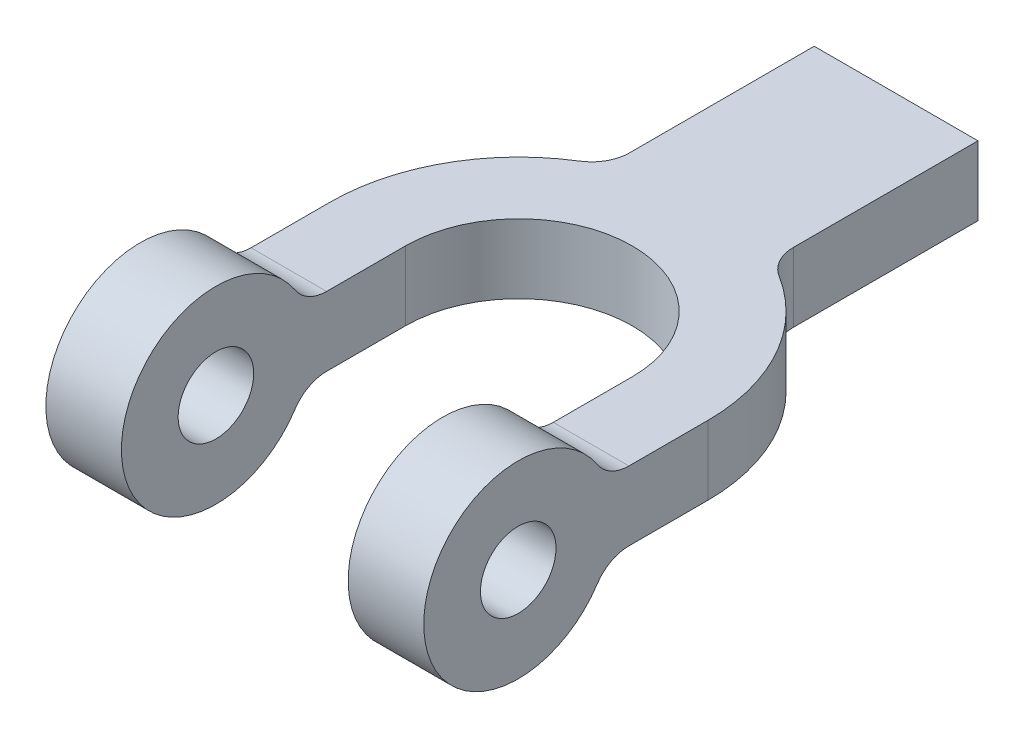
from build123d import *

# Parameters (mm, degrees)
SKETCH2_W           = 200
SKETCH2_H           = 350
BOSS_EXTRUDE1_DEPTH = 100
CUT_EXTRUDE3_DEPTH  = 226
SKETCH5_W           = 97.727308895
SKETCH5_H           = 31.680459025
CUT_EXTRUDE4_DEPTH  = 284.94541729


with BuildPart() as part:
    # Sketch2 → Boss-Extrude1 (new body)
    with BuildSketch(Plane(origin=(0, 0, 0), x_dir=(1, 0, 0), z_dir=(0, 1, 0))):
        Rectangle(SKETCH2_W, SKETCH2_H)
    extrude(amount=BOSS_EXTRUDE1_DEPTH)

    # Sketch4 → Cut-Extrude3 (cut, through all)
    with BuildSketch(Plane(origin=(0, 100, 0), x_dir=(1, 0, 0), z_dir=(0, 1, 0))):
        with BuildLine():
            Line((100, 175), (43.347633031, 175))
            Line((43.347633031, 175), (43.347633031, 77.272691105))
            ThreePointArc((43.347633031, 77.272691105), (45.866803863, 67.555664213), (52.789694192, 60.286522394))
            ThreePointArc((52.789694192, 60.286522394), (87.404145859, 23.940813259), (100, -24.644321249))
            Line((100, -24.644321249), (100, 175))
        make_face()
        with BuildLine():
            Line((-43.347633031, 77.272691105), (-43.347633031, 175))
            Line((-43.347633031, 175), (-100, 175))
            Line((-100, 175), (-100, -24.644321206))
            ThreePointArc((-100, -24.644321206), (-87.404145849, 23.940813278), (-52.789694192, 60.286522394))
            ThreePointArc((-52.789694192, 60.286522394), (-45.866803863, 67.555664213), (-43.347633031, 77.272691105))
        make_face()
        with BuildLine():
            Line((60, -175), (60, -24.644321162))
            ThreePointArc((60, -24.644321162), (0, 35.355678838), (-60, -24.644321162))
            Line((-60, -24.644321162), (-60, -175))
            Line((-60, -175), (60, -175))
        make_face()
    extrude(amount=-CUT_EXTRUDE3_DEPTH, mode=Mode.SUBTRACT)

    # Sketch5 → Cut-Extrude4 (cut, through all)
    with BuildSketch(Plane(origin=(100, 0, 0), x_dir=(0, 0, -1), z_dir=(1, 0, 0))):
        with BuildLine():
            Line((-175, 100), (-175, 50))
            ThreePointArc((-175, 50), (-160.355339059, 85.355339059), (-125, 100))
            Line((-125, 100), (-175, 100))
        make_face()
        with BuildLine():
            ThreePointArc((-105, 50), (-125, 70), (-145, 50))
            Line((-145, 50), (-105, 50))
        make_face()
        with BuildLine():
            Line((-105, 50), (-145, 50))
            ThreePointArc((-145, 50), (-125, 30), (-105, 50))
        make_face()
        with BuildLine():
            ThreePointArc((-125, 0), (-160.355339059, 14.644660941), (-175, 50))
            Line((-175, 50), (-175, 0))
            Line((-175, 0), (-125, 0))
        make_face()
        with BuildLine():
            ThreePointArc((-83.15716493, 22.628899304), (-101.215078672, 6.019578022), (-125, 0))
            Line((-125, 0), (-24.644321162, 0))
            Line((-24.644321162, 0), (-24.644321162, 31.680459025))
            Line((-24.644321162, 31.680459025), (-66.420030902, 31.680459025))
            ThreePointArc((-66.420030902, 31.680459025), (-75.933999434, 29.272627817), (-83.15716493, 22.628899304))
        make_face()
        with BuildLine():
            Line((-124.644321162, 100), (-125, 100))
            ThreePointArc((-125, 100), (-101.215078672, 93.980421978), (-83.15716493, 77.371100696))
            ThreePointArc((-83.15716493, 77.371100696), (-75.933999434, 70.727372183), (-66.420030902, 68.319540975))
            Line((-66.420030902, 68.319540975), (-24.644321162, 68.319540975))
            Line((-24.644321162, 68.319540975), (-24.644321162, 100))
            Line((-24.644321162, 100), (-124.644321162, 100))
        make_face()
        Polygon((60.286522394, 100), (-24.644321162, 100), (-24.644321162, 68.319540975), (77.272691105, 68.319540975), (77.272691105, 100), align=None)
        Polygon((-24.644321162, 31.680459025), (-24.644321162, 0), (60.286522394, 0), (77.272691105, 0), (77.272691105, 31.680459025), align=None)
        with Locations((126.136345553, 15.840229513)):
            Rectangle(SKETCH5_W, SKETCH5_H)
        with Locations((126.136345553, 84.159770487)):
            Rectangle(SKETCH5_W, SKETCH5_H)
    extrude(amount=-CUT_EXTRUDE4_DEPTH, mode=Mode.SUBTRACT)


solid = part.part
